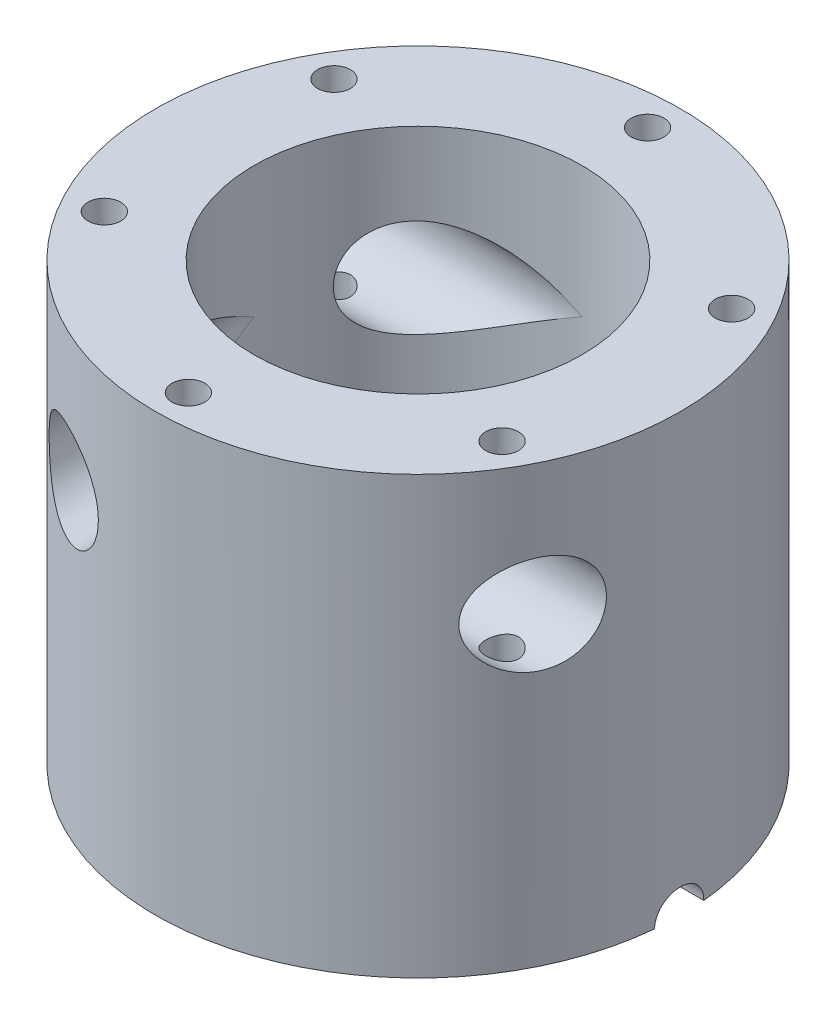
from build123d import *

# Parameters (mm, degrees)
SKETCH1_R                = 20.32
CYLINDER_DEPTH           = 36.322
SKETCH18_R               = 12.7
CUT_EXTRUDE10_DEPTH      = 30.988
SKETCH19_R               = 1.905
CUT_EXTRUDE12_REACH      = 48.315
SKETCH21_R               = 1.27
CIRPATTERN4_COUNT        = 6
CUT_EXTRUDE13_REACH      = 44.262
SKETCH22_R               = 8.001
CUT_EXTRUDE15_REACH      = 60.17
SKETCH25_R               = 1.905
CIRPATTERN6_COUNT        = 2
SKETCH29_R               = 3.81
CUT_EXTRUDE19_DEPTH      = 47.315143305
CIRPATTERN7_COUNT        = 4
CUT_EXTRUDE17_DEPTH      = 47.315143305
CUT_EXTRUDE17_DEPTH_BACK = 47.315143305
SKETCH27_W               = 40.64
SKETCH27_H               = 2.54


with BuildPart() as part:
    # Sketch1 → Cylinder (new body)
    with BuildSketch(Plane(origin=(0, 0, 0), x_dir=(1, 0, 0), z_dir=(0, 1, 0))):
        Circle(SKETCH1_R)
    extrude(amount=CYLINDER_DEPTH)

    # Sketch18 → Cut-Extrude10 (cut)
    with BuildSketch(Plane(origin=(0, 36.322, 0), x_dir=(1, 0, 0), z_dir=(0, 1, 0))):
        Circle(SKETCH18_R)
    extrude(amount=-CUT_EXTRUDE10_DEPTH, mode=Mode.SUBTRACT)

    # Sketch19 → Cut-Revolve7 (revolve, cut)
    with BuildSketch(Plane.XY):
        with Locations((12.573, 0)):
            Circle(SKETCH19_R)
    revolve(axis=Axis((0, 13.335, 0), (0, -1, 0)), mode=Mode.SUBTRACT)

    # Sketch21 → Cut-Extrude12 (cut, up to next)
    with BuildSketch(Plane(origin=(0, 36.322, 0), x_dir=(1, 0, 0), z_dir=(0, 1, 0)), mode=Mode.PRIVATE) as cut_extrude12_sk1:
        with Locations((0, 17.78)):
            Circle(SKETCH21_R)
    cut_extrude12_tool1 = extrude(cut_extrude12_sk1.sketch, amount=-CUT_EXTRUDE12_REACH, mode=Mode.PRIVATE) & part.part
    cut_extrude12 = cut_extrude12_tool1.solids().sort_by_distance((0, 36.322, -17.78))[0]
    add(cut_extrude12, mode=Mode.SUBTRACT)

    # CirPattern4: Cut-Extrude12 ×6 about axis
    cirpattern4_axis = Axis((0, 13.335, 0), (0, -1, 0))
    for i in range(1, CIRPATTERN4_COUNT):
        add(cut_extrude12.rotate(cirpattern4_axis, i * 360 / CIRPATTERN4_COUNT), mode=Mode.SUBTRACT)

    # Sketch22 → Cut-Extrude13 (cut, up to next)
    with BuildSketch(Plane(origin=(0, 5.334, 0), x_dir=(1, 0, 0), z_dir=(0, 1, 0)), mode=Mode.PRIVATE) as cut_extrude13_sk1:
        Circle(SKETCH22_R)
    cut_extrude13_tool1 = extrude(cut_extrude13_sk1.sketch, amount=-CUT_EXTRUDE13_REACH, mode=Mode.PRIVATE) & part.part
    add(cut_extrude13_tool1.solids().sort_by_distance((0, 5.334, 0))[0], mode=Mode.SUBTRACT)

    # Sketch25 → Cut-Extrude15 (cut, up to next)
    with BuildSketch(Plane(origin=(20.32, 0, 0), x_dir=(0, 0, -1), z_dir=(1, 0, 0)), mode=Mode.PRIVATE) as cut_extrude15_sk1:
        Circle(SKETCH25_R)
    cut_extrude15_tool1 = extrude(cut_extrude15_sk1.sketch, amount=-CUT_EXTRUDE15_REACH, mode=Mode.PRIVATE) & part.part
    cut_extrude15 = cut_extrude15_tool1.solids().sort_by_distance((20.32, 0, 0))[0]
    add(cut_extrude15, mode=Mode.SUBTRACT)

    # CirPattern6: Cut-Extrude15 ×2 about axis
    cirpattern6_axis = Axis((0, 13.335, 0), (0, -1, 0))
    for i in range(1, CIRPATTERN6_COUNT):
        add(cut_extrude15.rotate(cirpattern6_axis, i * 360 / CIRPATTERN6_COUNT), mode=Mode.SUBTRACT)

    # Sketch29 → Cut-Extrude19 (cut, through all)
    with BuildSketch(Plane.XY):
        with Locations((8.89, 23.622)):
            Circle(SKETCH29_R)
    cut_extrude19 = extrude(amount=-CUT_EXTRUDE19_DEPTH, mode=Mode.SUBTRACT)

    # CirPattern7: Cut-Extrude19 ×4 about axis
    cirpattern7_axis = Axis((0, 36.322, 0), (0, 1, 0))
    for i in range(1, CIRPATTERN7_COUNT):
        add(cut_extrude19.rotate(cirpattern7_axis, i * 360 / CIRPATTERN7_COUNT), mode=Mode.SUBTRACT)

    # Sketch27 → Cut-Extrude17 (cut, two sides: drawn at the far end of the back side and taken through both)
    with BuildSketch(Plane.XY.offset(-CUT_EXTRUDE17_DEPTH_BACK)):
        with Locations((0, 35.052)):
            Rectangle(SKETCH27_W, SKETCH27_H)
    extrude(amount=CUT_EXTRUDE17_DEPTH + CUT_EXTRUDE17_DEPTH_BACK, mode=Mode.SUBTRACT)


solid = part.part
